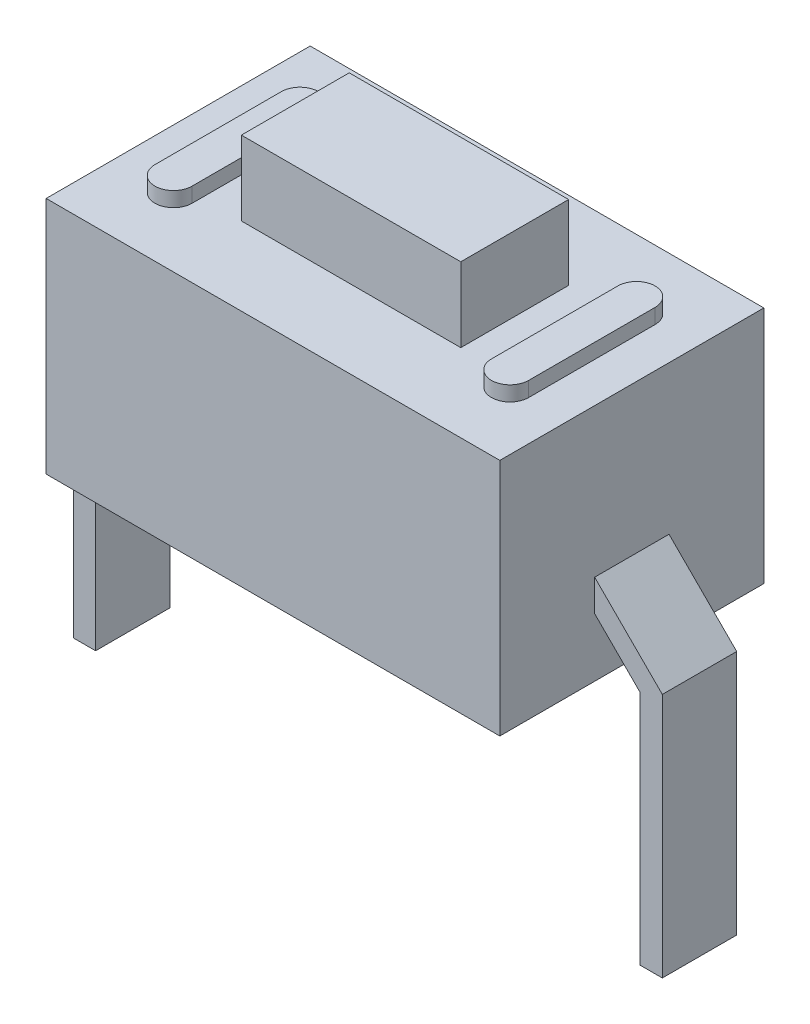
from build123d import *

# Parameters (mm, degrees)
SKETCH1_W           = 6.1
SKETCH1_H           = 3.55
BOSS_EXTRUDE1_DEPTH = 3.21
SKETCH2_W           = 2.95
SKETCH2_H           = 1.45
BOSS_EXTRUDE2_DEPTH = 1
BOSS_EXTRUDE3_DEPTH = 0.2
EXTRUDE_THIN1_DEPTH = 0.5


with BuildPart() as part:
    # Sketch1 → Boss-Extrude1 (new body)
    with BuildSketch(Plane(origin=(0, 0, 0), x_dir=(1, 0, 0), z_dir=(0, 1, 0))):
        Rectangle(SKETCH1_W, SKETCH1_H)
    extrude(amount=BOSS_EXTRUDE1_DEPTH)

    # Sketch2 → Boss-Extrude2 (add)
    with BuildSketch(Plane(origin=(0, 3.21, 0), x_dir=(1, 0, 0), z_dir=(0, 1, 0))):
        Rectangle(SKETCH2_W, SKETCH2_H)
    extrude(amount=BOSS_EXTRUDE2_DEPTH)

    # Sketch3 → Boss-Extrude3 (add)
    with BuildSketch(Plane(origin=(0, 3.21, 0), x_dir=(1, 0, 0), z_dir=(0, 1, 0))):
        with BuildLine():
            Line((-2.0125, 0.85), (-2.0125, -0.85))
            ThreePointArc((-2.0125, -0.85), (-2.2625, -1.1), (-2.5125, -0.85))
            Line((-2.5125, -0.85), (-2.5125, 0.85))
            ThreePointArc((-2.5125, 0.85), (-2.2625, 1.1), (-2.0125, 0.85))
        make_face()
        with BuildLine():
            Line((2.0125, 0.85), (2.0125, -0.85))
            ThreePointArc((2.0125, -0.85), (2.2625, -1.1), (2.5125, -0.85))
            Line((2.5125, -0.85), (2.5125, 0.85))
            ThreePointArc((2.5125, 0.85), (2.2625, 1.1), (2.0125, 0.85))
        make_face()
    extrude(amount=BOSS_EXTRUDE3_DEPTH)

    # Sketch4 → Extrude-Thin1 (add, symmetric)
    with BuildSketch(Plane.XY):
        Polygon((-2.653608324, 1.60852371), (-3.96, 0.302132034), (-3.96, -3), (-3.66, -3), (-3.66, 0.177867966), (-2.44147629, 1.396391676), align=None)
        Polygon((2.44147629, 1.396391676), (3.66, 0.177867966), (3.66, -3), (3.96, -3), (3.96, 0.302132034), (2.653608324, 1.60852371), align=None)
    extrude(amount=EXTRUDE_THIN1_DEPTH, both=True)


solid = part.part
